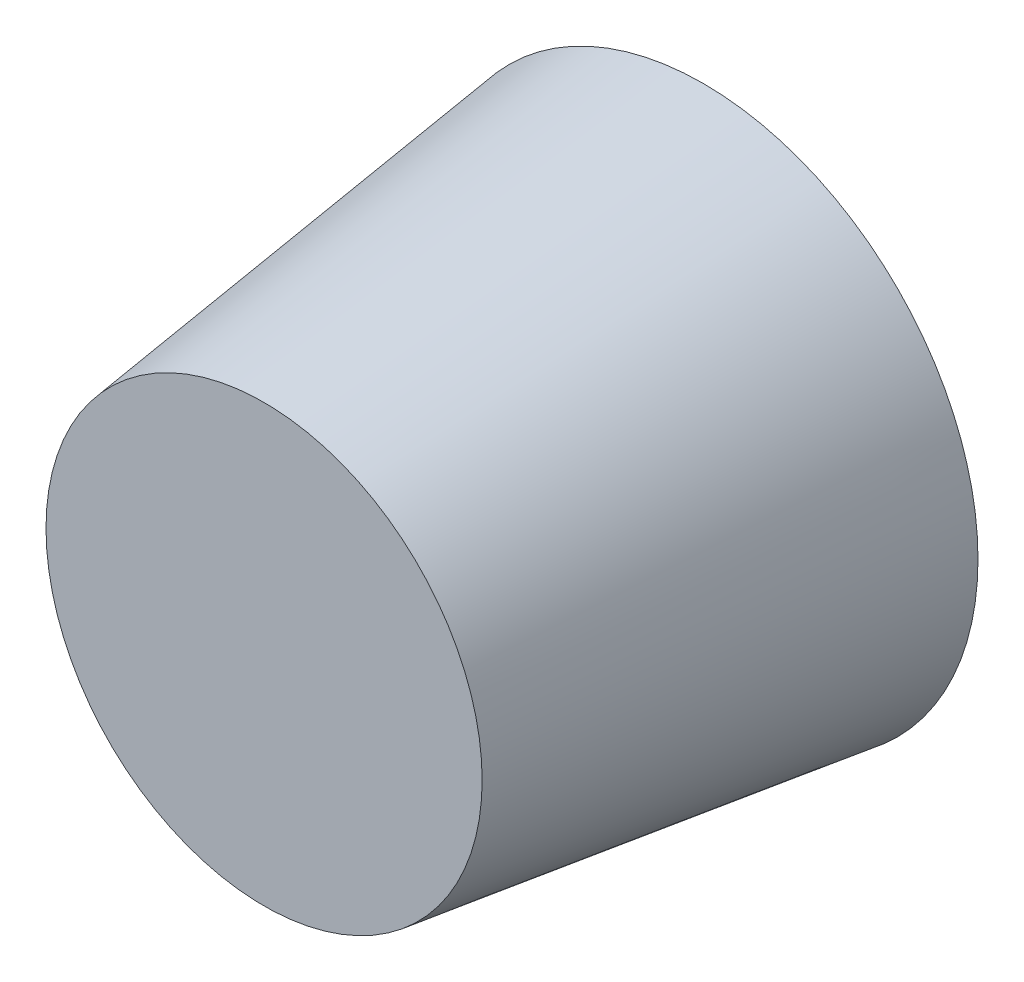
from build123d import *

# Parameters (mm, degrees)
CROQUIS1_R              = 5
SALIENTE_EXTRUIR1_DEPTH = 8
CROQUIS4_R              = 2.55
CORTAR_EXTRUIR1_DEPTH   = 4


with BuildPart() as part:
    # Croquis1 → Saliente-Extruir1 (new body)
    with BuildSketch(Plane.XY):
        Circle(CROQUIS1_R)
    extrude(amount=SALIENTE_EXTRUIR1_DEPTH)

    # Croquis3 → Cortar-Revolución2 (revolve, cut)
    with BuildSketch(Plane(origin=(0, 0, 0), x_dir=(0, 0, -1), z_dir=(1, 0, 0)), mode=Mode.PRIVATE) as cortar_revoluci_n2_sk:
        Polygon((-8, 3.970963049), (0, 5), (-8, 5), align=None)
    revolve(cortar_revoluci_n2_sk.sketch.rotate(Axis((0, 0, 8), (0, 0, -1)), 90), axis=Axis((0, 0, 8), (0, 0, -1)), mode=Mode.SUBTRACT)

    # Croquis4 → Cortar-Extruir1 (cut)
    with BuildSketch(Plane(origin=(0, 0, 0), x_dir=(-1, 0, 0), z_dir=(0, 0, -1))):
        Circle(CROQUIS4_R)
    extrude(amount=-CORTAR_EXTRUIR1_DEPTH, mode=Mode.SUBTRACT)


solid = part.part
